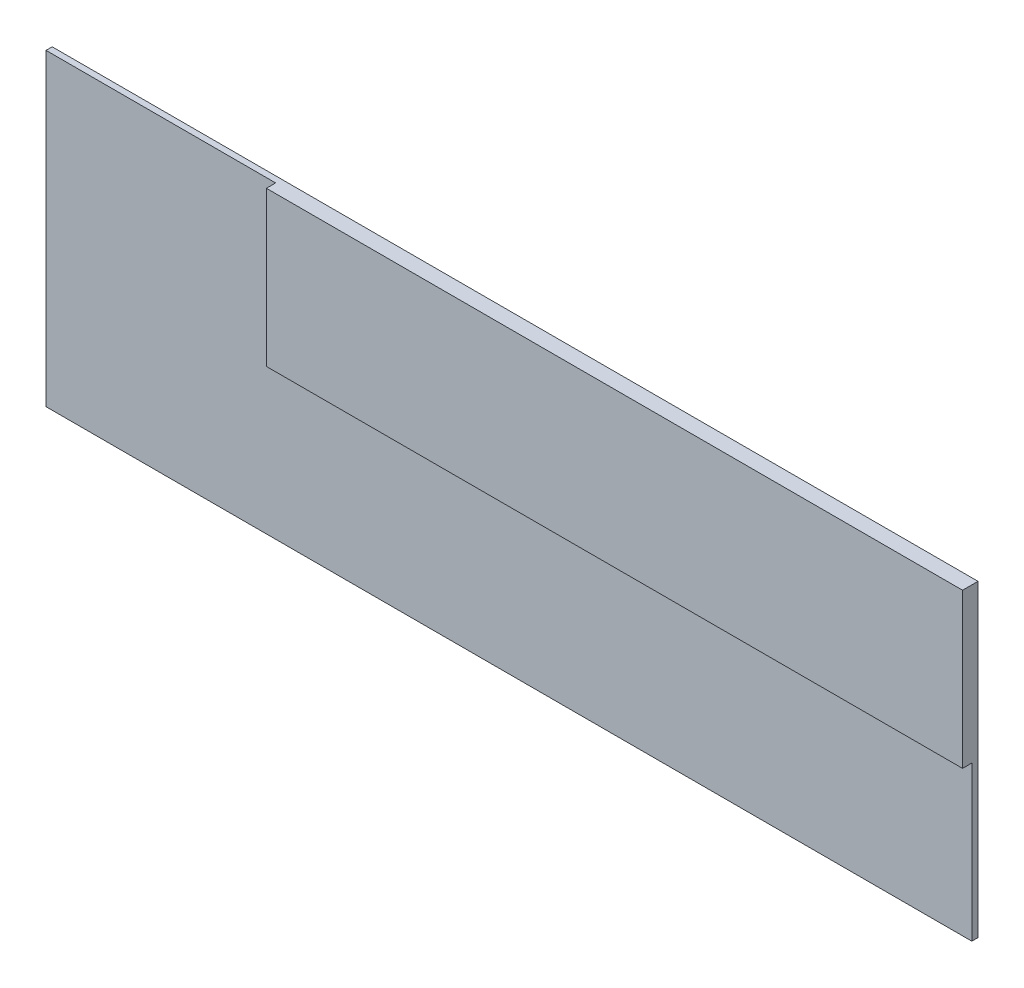
from build123d import *

# Parameters (mm, degrees)
SKETCH1_W           = 15000
SKETCH1_H           = 5000
BOSS_EXTRUDE1_DEPTH = 100
SKETCH2_W           = 11279.180041077
SKETCH2_H           = 2500
BOSS_EXTRUDE2_DEPTH = 150


with BuildPart() as part:
    # Sketch1 → Boss-Extrude1 (new body)
    with BuildSketch(Plane.XY):
        with Locations((5000, 0)):
            Rectangle(SKETCH1_W, SKETCH1_H)
    extrude(amount=-BOSS_EXTRUDE1_DEPTH)

    # Sketch2 → Boss-Extrude2 (add)
    with BuildSketch(Plane.XY):
        with Locations((6860.409979462, 1250)):
            Rectangle(SKETCH2_W, SKETCH2_H)
    extrude(amount=BOSS_EXTRUDE2_DEPTH)


solid = part.part
